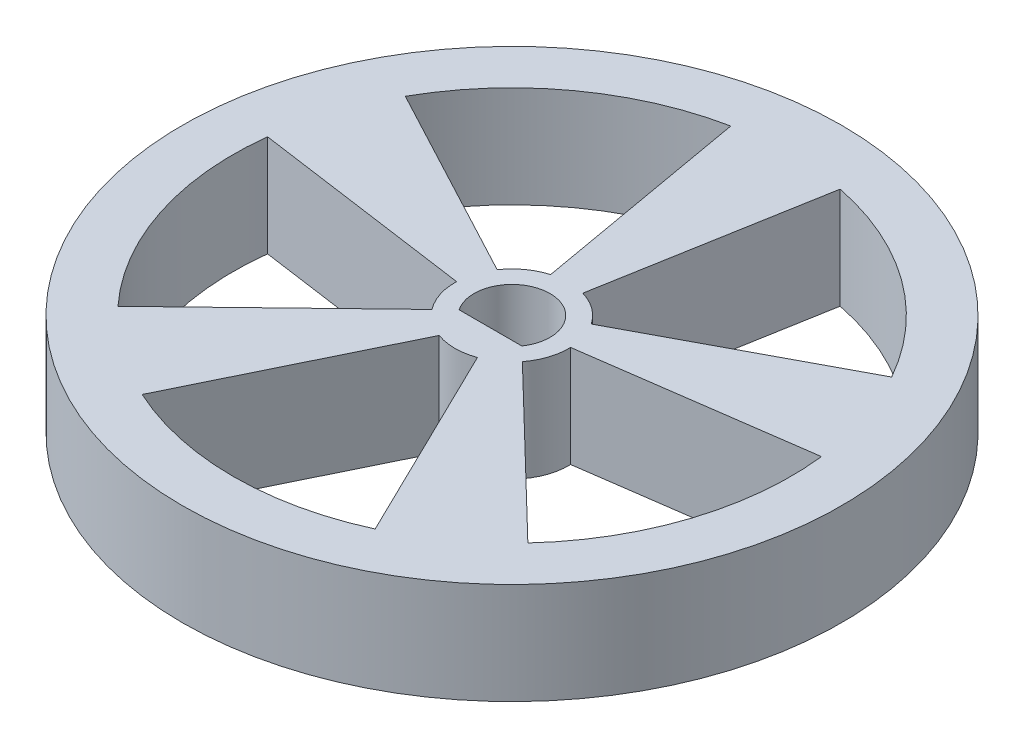
from build123d import *

# Parameters (mm, degrees)
SKETCH1_R           = 13
BOSS_EXTRUDE1_DEPTH = 4
SKETCH1_4_R         = 1.5
BOSS_EXTRUDE2_DEPTH = 0.5


with BuildPart() as part:
    # Sketch1 → Boss-Extrude1 (new body)
    with BuildSketch(Plane(origin=(0, 0, 0), x_dir=(1, 0, 0), z_dir=(0, 1, 0))):
        Circle(SKETCH1_R)
        with BuildLine():
            Line((1.235920709, -0.85), (-1.235920709, -0.85))
            ThreePointArc((-1.235920709, -0.85), (0, 1.5), (1.235920709, -0.85))
        make_face(mode=Mode.SUBTRACT)
        with BuildLine():
            ThreePointArc((1.85666335, 1.270945004), (1.322516818, 1.820288237), (0.635, 2.158535383))
            Line((0.635, 2.158535383), (2.156355605, 10.786571768))
            ThreePointArc((2.156355605, 10.786571768), (6.465637775, 8.899186938), (9.59228884, 5.384050037))
            Line((9.59228884, 5.384050037), (1.85666335, 1.270945004))
        make_face(mode=Mode.SUBTRACT)
        with BuildLine():
            Line((2.249114933, 0.063103228), (10.924989896, 1.282417938))
            ThreePointArc((10.924989896, 1.282417938), (10.461621679, -3.399186938), (8.084716138, -7.459045848))
            Line((8.084716138, -7.459045848), (1.782481056, -1.373048173))
            ThreePointArc((1.782481056, -1.373048173), (2.139877162, -0.695288237), (2.249114933, 0.063103228))
        make_face(mode=Mode.SUBTRACT)
        with BuildLine():
            ThreePointArc((-0.755029473, -2.119535443), (0, -2.25), (0.755029473, -2.119535443))
            Line((0.755029473, -2.119535443), (4.595659477, -9.993993895))
            ThreePointArc((4.595659477, -9.993993895), (0, -11), (-4.595659477, -9.993993895))
            Line((-4.595659477, -9.993993895), (-0.755029473, -2.119535443))
        make_face(mode=Mode.SUBTRACT)
        with BuildLine():
            ThreePointArc((-2.249114933, 0.063103228), (-2.139877162, -0.695288237), (-1.782481056, -1.373048173))
            Line((-1.782481056, -1.373048173), (-8.084716138, -7.459045848))
            ThreePointArc((-8.084716138, -7.459045848), (-10.461621679, -3.399186938), (-10.924989896, 1.282417938))
            Line((-10.924989896, 1.282417938), (-2.249114933, 0.063103228))
        make_face(mode=Mode.SUBTRACT)
        with BuildLine():
            ThreePointArc((-0.635, 2.158535383), (-1.322516818, 1.820288237), (-1.85666335, 1.270945004))
            Line((-1.85666335, 1.270945004), (-9.59228884, 5.384050037))
            ThreePointArc((-9.59228884, 5.384050037), (-6.465637775, 8.899186938), (-2.156355605, 10.786571768))
            Line((-2.156355605, 10.786571768), (-0.635, 2.158535383))
        make_face(mode=Mode.SUBTRACT)
    extrude(amount=BOSS_EXTRUDE1_DEPTH)

    # Sketch1<4> → Boss-Extrude2 (add)
    with BuildSketch(Plane(origin=(0, 0, 0), x_dir=(1, 0, 0), z_dir=(0, 1, 0))):
        Circle(SKETCH1_4_R)
    extrude(amount=BOSS_EXTRUDE2_DEPTH)


solid = part.part
